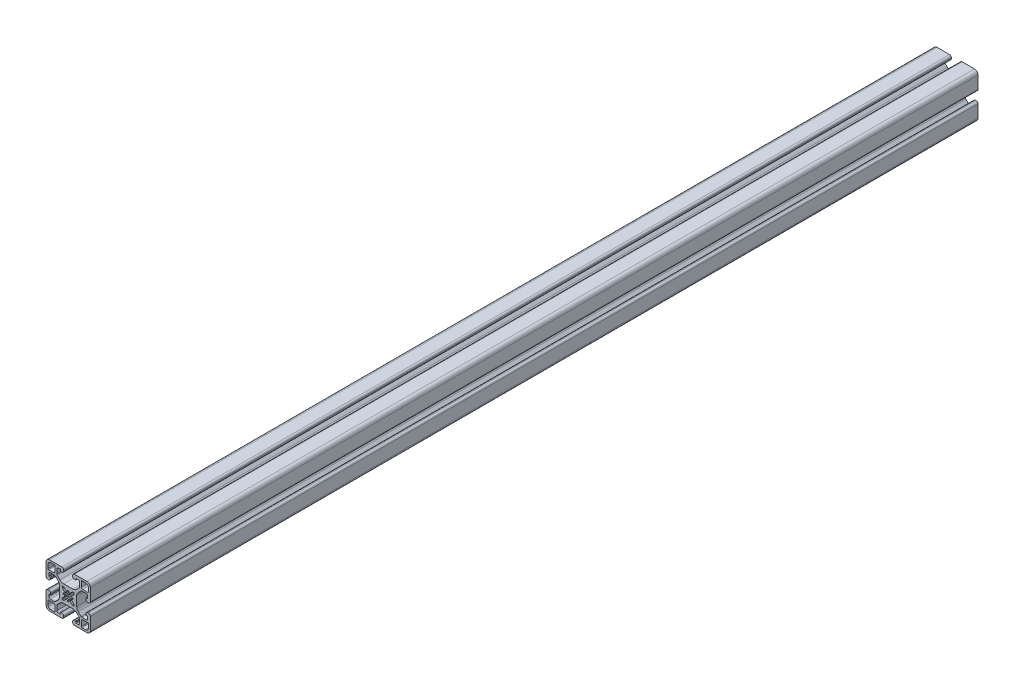
from build123d import *

# Parameters (mm, degrees)
EXTRUDE1_DEPTH = 800


with BuildPart() as part:
    # Sketch1 → Extrude1 (new body)
    with BuildSketch(Plane.XY):
        with BuildLine():
            Line((-5.63, 20), (-16.83, 20))
            ThreePointArc((-16.83, 20), (-19.071528496, 19.071528497), (-20, 16.83))
            Line((-20, 16.83), (-20, 5.63))
            ThreePointArc((-20, 5.63), (-19.540157646, 4.519842354), (-18.43, 4.06))
            Line((-18.43, 4.06), (-17.57, 4.06))
            ThreePointArc((-17.57, 4.06), (-16.459842353, 4.519842354), (-16, 5.63))
            Line((-16, 5.63), (-16, 6.605))
            ThreePointArc((-16, 6.605), (-16.073223305, 6.781776695), (-16.25, 6.855))
            Line((-16.25, 6.855), (-17.25, 6.855))
            ThreePointArc((-17.25, 6.855), (-17.426776695, 6.928223305), (-17.5, 7.105))
            Line((-17.5, 7.105), (-17.5, 9.015))
            ThreePointArc((-17.5, 9.015), (-17.128025612, 9.913025612), (-16.23, 10.285))
            Line((-16.23, 10.285), (-12.216214636, 10.285))
            ThreePointArc((-12.216214636, 10.285), (-11.875626381, 10.217252784), (-11.5868896, 10.024325035))
            Line((-11.5868896, 10.024325035), (-9.076242789, 7.513678224))
            ThreePointArc((-9.076242789, 7.513678224), (-8.046572221, 5.972667318), (-7.685, 4.154921014))
            Line((-7.685, 4.154921014), (-7.685, -4.154921014))
            ThreePointArc((-7.685, -4.154921014), (-8.046572221, -5.972667317), (-9.076242789, -7.513678224))
            Line((-9.076242789, -7.513678224), (-11.5868896, -10.024325035))
            ThreePointArc((-11.5868896, -10.024325035), (-11.875626381, -10.217252784), (-12.216214636, -10.285))
            Line((-12.216214636, -10.285), (-16.23, -10.285))
            ThreePointArc((-16.23, -10.285), (-17.128025612, -9.913025612), (-17.5, -9.015))
            Line((-17.5, -9.015), (-17.5, -7.105))
            ThreePointArc((-17.5, -7.105), (-17.426776695, -6.928223305), (-17.25, -6.855))
            Line((-17.25, -6.855), (-16.25, -6.855))
            ThreePointArc((-16.25, -6.855), (-16.073223305, -6.781776695), (-16, -6.605))
            Line((-16, -6.605), (-16, -5.63))
            ThreePointArc((-16, -5.63), (-16.459842354, -4.519842353), (-17.57, -4.06))
            Line((-17.57, -4.06), (-18.43, -4.06))
            ThreePointArc((-18.43, -4.06), (-19.540157646, -4.519842353), (-20, -5.63))
            Line((-20, -5.63), (-20, -16.83))
            ThreePointArc((-20, -16.83), (-19.071528496, -19.071528496), (-16.83, -20))
            Line((-16.83, -20), (-5.63, -20))
            ThreePointArc((-5.63, -20), (-4.519842354, -19.540157646), (-4.06, -18.43))
            Line((-4.06, -18.43), (-4.06, -17.57))
            ThreePointArc((-4.06, -17.57), (-4.519842354, -16.459842353), (-5.63, -16))
            Line((-5.63, -16), (-6.605, -16))
            ThreePointArc((-6.605, -16), (-6.781776695, -16.073223305), (-6.855, -16.25))
            Line((-6.855, -16.25), (-6.855, -17.25))
            ThreePointArc((-6.855, -17.25), (-6.928223305, -17.426776695), (-7.105, -17.5))
            Line((-7.105, -17.5), (-9.015, -17.5))
            ThreePointArc((-9.015, -17.5), (-9.913025612, -17.128025612), (-10.285, -16.23))
            Line((-10.285, -16.23), (-10.285, -12.216214635))
            ThreePointArc((-10.285, -12.216214635), (-10.217252784, -11.875626381), (-10.024325035, -11.5868896))
            Line((-10.024325035, -11.5868896), (-7.513678224, -9.076242789))
            ThreePointArc((-7.513678224, -9.076242789), (-5.972667317, -8.04657222), (-4.154921014, -7.685))
            Line((-4.154921014, -7.685), (4.154921014, -7.685))
            ThreePointArc((4.154921014, -7.685), (5.972667317, -8.04657222), (7.513678224, -9.076242789))
            Line((7.513678224, -9.076242789), (10.024325035, -11.5868896))
            ThreePointArc((10.024325035, -11.5868896), (10.217252784, -11.875626381), (10.285, -12.216214636))
            Line((10.285, -12.216214636), (10.285, -16.23))
            ThreePointArc((10.285, -16.23), (9.913025612, -17.128025612), (9.015, -17.5))
            Line((9.015, -17.5), (7.105, -17.5))
            ThreePointArc((7.105, -17.5), (6.928223305, -17.426776695), (6.855, -17.25))
            Line((6.855, -17.25), (6.855, -16.25))
            ThreePointArc((6.855, -16.25), (6.781776695, -16.073223305), (6.605, -16))
            Line((6.605, -16), (5.63, -16))
            ThreePointArc((5.63, -16), (4.519842354, -16.459842353), (4.06, -17.57))
            Line((4.06, -17.57), (4.06, -18.43))
            ThreePointArc((4.06, -18.43), (4.519842354, -19.540157646), (5.63, -20))
            Line((5.63, -20), (16.83, -20))
            ThreePointArc((16.83, -20), (19.071528496, -19.071528496), (20, -16.83))
            Line((20, -16.83), (20, -5.63))
            ThreePointArc((20, -5.63), (19.540157646, -4.519842353), (18.43, -4.06))
            Line((18.43, -4.06), (17.57, -4.06))
            ThreePointArc((17.57, -4.06), (16.459842354, -4.519842353), (16, -5.63))
            Line((16, -5.63), (16, -6.605))
            ThreePointArc((16, -6.605), (16.073223305, -6.781776695), (16.25, -6.855))
            Line((16.25, -6.855), (17.25, -6.855))
            ThreePointArc((17.25, -6.855), (17.426776695, -6.928223305), (17.5, -7.105))
            Line((17.5, -7.105), (17.5, -9.015))
            ThreePointArc((17.5, -9.015), (17.128025612, -9.913025612), (16.23, -10.285))
            Line((16.23, -10.285), (12.216214636, -10.285))
            ThreePointArc((12.216214636, -10.285), (11.875626381, -10.217252784), (11.5868896, -10.024325035))
            Line((11.5868896, -10.024325035), (9.076242789, -7.513678224))
            ThreePointArc((9.076242789, -7.513678224), (8.046572221, -5.972667317), (7.685, -4.154921014))
            Line((7.685, -4.154921014), (7.685, 4.154921014))
            ThreePointArc((7.685, 4.154921014), (8.046572221, 5.972667318), (9.076242789, 7.513678224))
            Line((9.076242789, 7.513678224), (11.5868896, 10.024325035))
            ThreePointArc((11.5868896, 10.024325035), (11.875626381, 10.217252784), (12.216214636, 10.285))
            Line((12.216214636, 10.285), (16.23, 10.285))
            ThreePointArc((16.23, 10.285), (17.128025612, 9.913025612), (17.5, 9.015))
            Line((17.5, 9.015), (17.5, 7.105))
            ThreePointArc((17.5, 7.105), (17.426776695, 6.928223305), (17.25, 6.855))
            Line((17.25, 6.855), (16.25, 6.855))
            ThreePointArc((16.25, 6.855), (16.073223305, 6.781776695), (16, 6.605))
            Line((16, 6.605), (16, 5.63))
            ThreePointArc((16, 5.63), (16.459842354, 4.519842354), (17.57, 4.06))
            Line((17.57, 4.06), (18.43, 4.06))
            ThreePointArc((18.43, 4.06), (19.540157646, 4.519842354), (20, 5.63))
            Line((20, 5.63), (20, 16.83))
            ThreePointArc((20, 16.83), (19.071528496, 19.071528496), (16.83, 20))
            Line((16.83, 20), (5.63, 20))
            ThreePointArc((5.63, 20), (4.519842354, 19.540157647), (4.06, 18.43))
            Line((4.06, 18.43), (4.06, 17.57))
            ThreePointArc((4.06, 17.57), (4.519842354, 16.459842354), (5.63, 16))
            Line((5.63, 16), (6.605, 16))
            ThreePointArc((6.605, 16), (6.781776695, 16.073223305), (6.855, 16.25))
            Line((6.855, 16.25), (6.855, 17.25))
            ThreePointArc((6.855, 17.25), (6.928223305, 17.426776695), (7.105, 17.5))
            Line((7.105, 17.5), (9.015, 17.5))
            ThreePointArc((9.015, 17.5), (9.913025612, 17.128025612), (10.285, 16.23))
            Line((10.285, 16.23), (10.285, 12.216214636))
            ThreePointArc((10.285, 12.216214636), (10.217252784, 11.875626381), (10.024325035, 11.5868896))
            Line((10.024325035, 11.5868896), (7.513678224, 9.07624279))
            ThreePointArc((7.513678224, 9.07624279), (5.972667317, 8.046572221), (4.154921014, 7.685))
            Line((4.154921014, 7.685), (-4.154921014, 7.685))
            ThreePointArc((-4.154921014, 7.685), (-5.972667317, 8.046572221), (-7.513678224, 9.07624279))
            Line((-7.513678224, 9.07624279), (-10.024325035, 11.5868896))
            ThreePointArc((-10.024325035, 11.5868896), (-10.217252784, 11.875626381), (-10.285, 12.216214636))
            Line((-10.285, 12.216214636), (-10.285, 16.23))
            ThreePointArc((-10.285, 16.23), (-9.913025612, 17.128025612), (-9.015, 17.5))
            Line((-9.015, 17.5), (-7.105, 17.5))
            ThreePointArc((-7.105, 17.5), (-6.928223305, 17.426776695), (-6.855, 17.25))
            Line((-6.855, 17.25), (-6.855, 16.25))
            ThreePointArc((-6.855, 16.25), (-6.781776695, 16.073223305), (-6.605, 16))
            Line((-6.605, 16), (-5.63, 16))
            ThreePointArc((-5.63, 16), (-4.519842354, 16.459842354), (-4.06, 17.57))
            Line((-4.06, 17.57), (-4.06, 18.43))
            ThreePointArc((-4.06, 18.43), (-4.519842354, 19.540157647), (-5.63, 20))
        make_face()
        with BuildLine():
            Line((12.4898, -18.345), (15.545, -18.345))
            ThreePointArc((15.545, -18.345), (17.524898987, -17.524898987), (18.345, -15.545))
            Line((18.345, -15.545), (18.345, -12.4898))
            ThreePointArc((18.345, -12.4898), (18.160477272, -12.044322728), (17.715, -11.8598))
            Line((17.715, -11.8598), (13.1298, -11.8598))
            ThreePointArc((13.1298, -11.8598), (12.231774388, -12.231774388), (11.8598, -13.1298))
            Line((11.8598, -13.1298), (11.8598, -17.715))
            ThreePointArc((11.8598, -17.715), (12.044322728, -18.160477272), (12.4898, -18.345))
        make_face(mode=Mode.SUBTRACT)
        with BuildLine():
            Line((-18.345, -12.4898), (-18.345, -15.545))
            ThreePointArc((-18.345, -15.545), (-17.524898987, -17.524898987), (-15.545, -18.345))
            Line((-15.545, -18.345), (-12.4898, -18.345))
            ThreePointArc((-12.4898, -18.345), (-12.044322728, -18.160477272), (-11.8598, -17.715))
            Line((-11.8598, -17.715), (-11.8598, -13.1298))
            ThreePointArc((-11.8598, -13.1298), (-12.231774388, -12.231774388), (-13.1298, -11.8598))
            Line((-13.1298, -11.8598), (-17.715, -11.8598))
            ThreePointArc((-17.715, -11.8598), (-18.160477272, -12.044322728), (-18.345, -12.4898))
        make_face(mode=Mode.SUBTRACT)
        with BuildLine():
            Line((18.345, 12.4898), (18.345, 15.545))
            ThreePointArc((18.345, 15.545), (17.524898987, 17.524898987), (15.545, 18.345))
            Line((15.545, 18.345), (12.4898, 18.345))
            ThreePointArc((12.4898, 18.345), (12.044322728, 18.160477272), (11.8598, 17.715))
            Line((11.8598, 17.715), (11.8598, 13.1298))
            ThreePointArc((11.8598, 13.1298), (12.231774388, 12.231774388), (13.1298, 11.8598))
            Line((13.1298, 11.8598), (17.715, 11.8598))
            ThreePointArc((17.715, 11.8598), (18.160477272, 12.044322728), (18.345, 12.4898))
        make_face(mode=Mode.SUBTRACT)
        with BuildLine():
            Line((-12.4898, 18.345), (-15.545, 18.345))
            ThreePointArc((-15.545, 18.345), (-17.524898987, 17.524898987), (-18.345, 15.545))
            Line((-18.345, 15.545), (-18.345, 12.4898))
            ThreePointArc((-18.345, 12.4898), (-18.160477272, 12.044322728), (-17.715, 11.8598))
            Line((-17.715, 11.8598), (-13.1298, 11.8598))
            ThreePointArc((-13.1298, 11.8598), (-12.231774388, 12.231774388), (-11.8598, 13.1298))
            Line((-11.8598, 13.1298), (-11.8598, 17.715))
            ThreePointArc((-11.8598, 17.715), (-12.044322728, 18.160477272), (-12.4898, 18.345))
        make_face(mode=Mode.SUBTRACT)
        with BuildLine():
            Line((-4.84811685, -5.43930974), (-3.712038621, -5.126252183))
            Line((-3.712038621, -5.126252183), (-1.590718277, -3.00493184))
            ThreePointArc((-1.590718277, -3.00493184), (-1.120609643, -3.210020877), (-0.625, -3.342061489))
            Line((-0.625, -3.342061489), (-0.492259234, -4.087640441))
            ThreePointArc((-0.492259234, -4.087640441), (0, -4.5), (0.492259234, -4.087640441))
            Line((0.492259234, -4.087640441), (0.625, -3.342061489))
            ThreePointArc((0.625, -3.342061489), (1.120609643, -3.210020877), (1.590718277, -3.00493184))
            Line((1.590718277, -3.00493184), (3.712038621, -5.126252183))
            Line((3.712038621, -5.126252183), (4.84811685, -5.43930974))
            ThreePointArc((4.84811685, -5.43930974), (5.303300859, -5.303300859), (5.43930974, -4.84811685))
            Line((5.43930974, -4.84811685), (5.126252183, -3.712038621))
            Line((5.126252183, -3.712038621), (3.00493184, -1.590718277))
            ThreePointArc((3.00493184, -1.590718277), (3.210020877, -1.120609643), (3.342061489, -0.625))
            Line((3.342061489, -0.625), (4.087640441, -0.492259234))
            ThreePointArc((4.087640441, -0.492259234), (4.5, 0), (4.087640441, 0.492259234))
            Line((4.087640441, 0.492259234), (3.342061489, 0.625))
            ThreePointArc((3.342061489, 0.625), (3.210020877, 1.120609643), (3.00493184, 1.590718277))
            Line((3.00493184, 1.590718277), (5.126252183, 3.712038621))
            Line((5.126252183, 3.712038621), (5.43930974, 4.84811685))
            ThreePointArc((5.43930974, 4.84811685), (5.303300859, 5.303300859), (4.84811685, 5.43930974))
            Line((4.84811685, 5.43930974), (3.712038621, 5.126252183))
            Line((3.712038621, 5.126252183), (1.590718277, 3.00493184))
            ThreePointArc((1.590718277, 3.00493184), (1.120609643, 3.210020877), (0.625, 3.342061489))
            Line((0.625, 3.342061489), (0.492259234, 4.087640441))
            ThreePointArc((0.492259234, 4.087640441), (0, 4.5), (-0.492259234, 4.087640441))
            Line((-0.492259234, 4.087640441), (-0.625, 3.342061489))
            ThreePointArc((-0.625, 3.342061489), (-1.120609643, 3.210020877), (-1.590718277, 3.00493184))
            Line((-1.590718277, 3.00493184), (-3.712038621, 5.126252183))
            Line((-3.712038621, 5.126252183), (-4.84811685, 5.43930974))
            ThreePointArc((-4.84811685, 5.43930974), (-5.303300859, 5.303300859), (-5.43930974, 4.84811685))
            Line((-5.43930974, 4.84811685), (-5.126252183, 3.712038621))
            Line((-5.126252183, 3.712038621), (-3.00493184, 1.590718277))
            ThreePointArc((-3.00493184, 1.590718277), (-3.210020877, 1.120609643), (-3.342061489, 0.625))
            Line((-3.342061489, 0.625), (-4.087640441, 0.492259234))
            ThreePointArc((-4.087640441, 0.492259234), (-4.5, 0), (-4.087640441, -0.492259234))
            Line((-4.087640441, -0.492259234), (-3.342061489, -0.625))
            ThreePointArc((-3.342061489, -0.625), (-3.210020877, -1.120609643), (-3.00493184, -1.590718277))
            Line((-3.00493184, -1.590718277), (-5.126252183, -3.712038621))
            Line((-5.126252183, -3.712038621), (-5.43930974, -4.84811685))
            ThreePointArc((-5.43930974, -4.84811685), (-5.303300859, -5.303300859), (-4.84811685, -5.43930974))
        make_face(mode=Mode.SUBTRACT)
    extrude(amount=-EXTRUDE1_DEPTH)


solid = part.part
